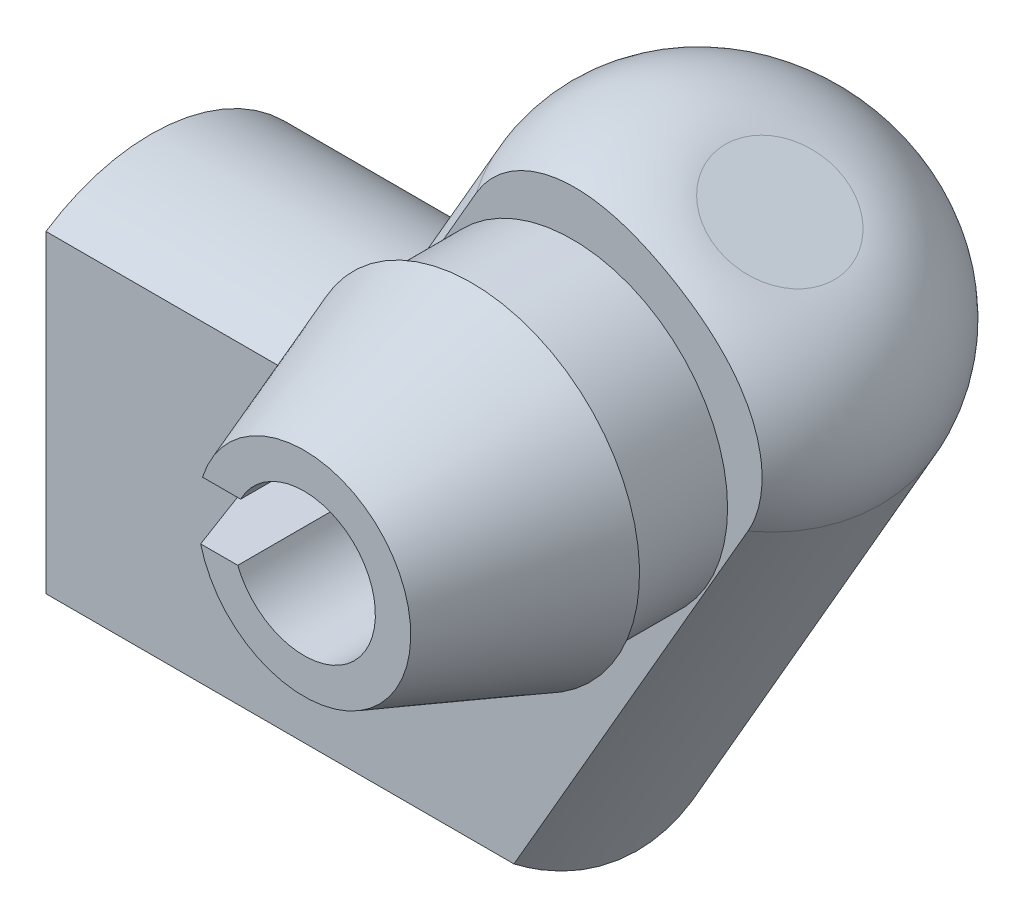
from build123d import *

# Parameters (mm, degrees)
SKETCH3_R           = 2.25
FILLET2_R           = 1.5
SKETCH4_R           = 1.125
SKETCH6_W           = 9.297020352
SKETCH6_H           = 8.256436423
CUT_EXTRUDE1_DEPTH  = 3
SKETCH7_R           = 1.85
BOSS_EXTRUDE2_DEPTH = 1.2
SKETCH8_R           = 2
BOSS_EXTRUDE3_DEPTH = 2
BOSS_EXTRUDE3_TAPER = 20
SKETCH9_R           = 0.85
CUT_EXTRUDE2_DEPTH  = 2.4
SKETCH10_W          = 1.535398486
SKETCH10_H          = 0.7
CUT_EXTRUDE3_DEPTH  = 2.4


with BuildPart() as part:
    # Sweep1: sweep along a path in Sketch2
    with BuildLine(Plane.XY) as sweep1_path:
        Line((-4.5, 0), (0, 0))
        Line((0, 0), (3, 5.196152423))
    # Sketch3 → Sweep1 (sweep)
    with BuildSketch(Plane(origin=(-4.5, 0, 0), x_dir=(0, 0, -1), z_dir=(1, 0, 0))):
        Circle(SKETCH3_R)
    sweep(path=sweep1_path.line, transition=Transition.RIGHT)

    # Fillet2
    fillet2_edges = [part.edges().sort_by_distance(p)[0] for p in [
        (3, 5.196152423, 2.25),
    ]]
    fillet(fillet2_edges, radius=FILLET2_R)

    # Cut-Sweep1: sweep along a path in Sketch5
    with BuildLine(Plane.XY) as cut_sweep1_path:
        Line((-4.5, 0), (1.2, 0))
    # Sketch4 → Cut-Sweep1 (sweep, cut)
    with BuildSketch(Plane.ZY.offset(4.5)):
        Circle(SKETCH4_R)
    sweep(path=cut_sweep1_path.line, mode=Mode.SUBTRACT)

    # Sketch6 → Cut-Extrude1 (cut)
    with BuildSketch(Plane.XY.offset(-1.25)):
        with Locations((-0.019421036, 1.725207659)):
            Rectangle(SKETCH6_W, SKETCH6_H)
    extrude(amount=-CUT_EXTRUDE1_DEPTH, mode=Mode.SUBTRACT)

    # Sketch7 → Boss-Extrude2 (add)
    with BuildSketch(Plane(origin=(0, 0, -1.25), x_dir=(-1, 0, 0), z_dir=(0, 0, -1))):
        with Locations(Location((-1.777414459, 3.078572149, 0), (0, 0, 180))):
            Circle(SKETCH7_R)
    extrude(amount=BOSS_EXTRUDE2_DEPTH)

    # Sketch8 → Boss-Extrude3 (add)
    with BuildSketch(Plane(origin=(0, 0, -2.45), x_dir=(-1, 0, 0), z_dir=(0, 0, -1))):
        with Locations((-1.777414459, 3.078572149)):
            Circle(SKETCH8_R)
    extrude(amount=BOSS_EXTRUDE3_DEPTH, taper=BOSS_EXTRUDE3_TAPER)

    # Sketch9 → Cut-Extrude2 (cut)
    with BuildSketch(Plane(origin=(0, 0, -4.45), x_dir=(-1, 0, 0), z_dir=(0, 0, -1))):
        with Locations((-1.777414459, 3.078572149)):
            Circle(SKETCH9_R)
    extrude(amount=-CUT_EXTRUDE2_DEPTH, mode=Mode.SUBTRACT)

    # Sketch10 → Cut-Extrude3 (cut)
    with BuildSketch(Plane(origin=(0, 0, -4.45), x_dir=(-1, 0, 0), z_dir=(0, 0, -1))):
        with Locations((-0.333609148, 3.11663504)):
            Rectangle(SKETCH10_W, SKETCH10_H)
    extrude(amount=-CUT_EXTRUDE3_DEPTH, mode=Mode.SUBTRACT)


with BuildPart() as body_2:
    # Mirror1: mirrored copy
    add(part.part.mirror(Plane.XY.offset(-10)))


solid = body_2.part
